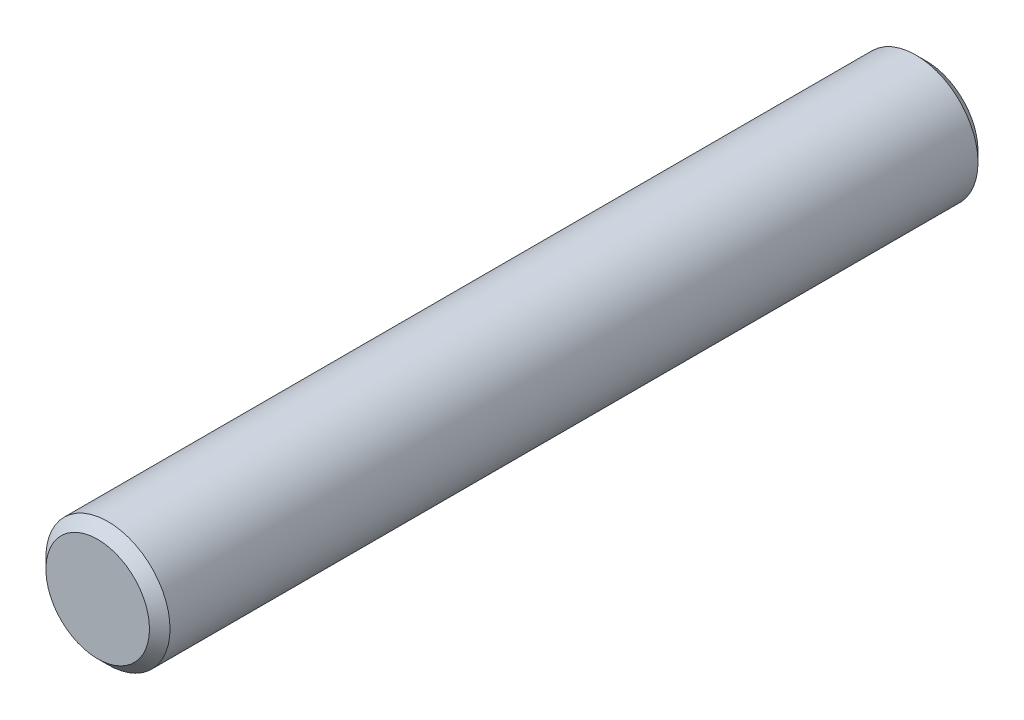
from build123d import *

# Parameters (mm, degrees)
SKETCH1_R           = 0.3745
BOSS_EXTRUDE1_DEPTH = 2.5
CHAMFER1_SIZE       = 0.062


with BuildPart() as part:
    # Sketch1 → Boss-Extrude1 (new, symmetric)
    with BuildSketch(Plane.XY):
        Circle(SKETCH1_R)
    extrude(amount=BOSS_EXTRUDE1_DEPTH, both=True)

    # Chamfer1
    chamfer1_edges = [part.edges().sort_by_distance(p)[0] for p in [
        (-0.3745, 0, -2.5),
        (-0.3745, 0, 2.5),
    ]]
    chamfer(chamfer1_edges, length=CHAMFER1_SIZE)


solid = part.part
